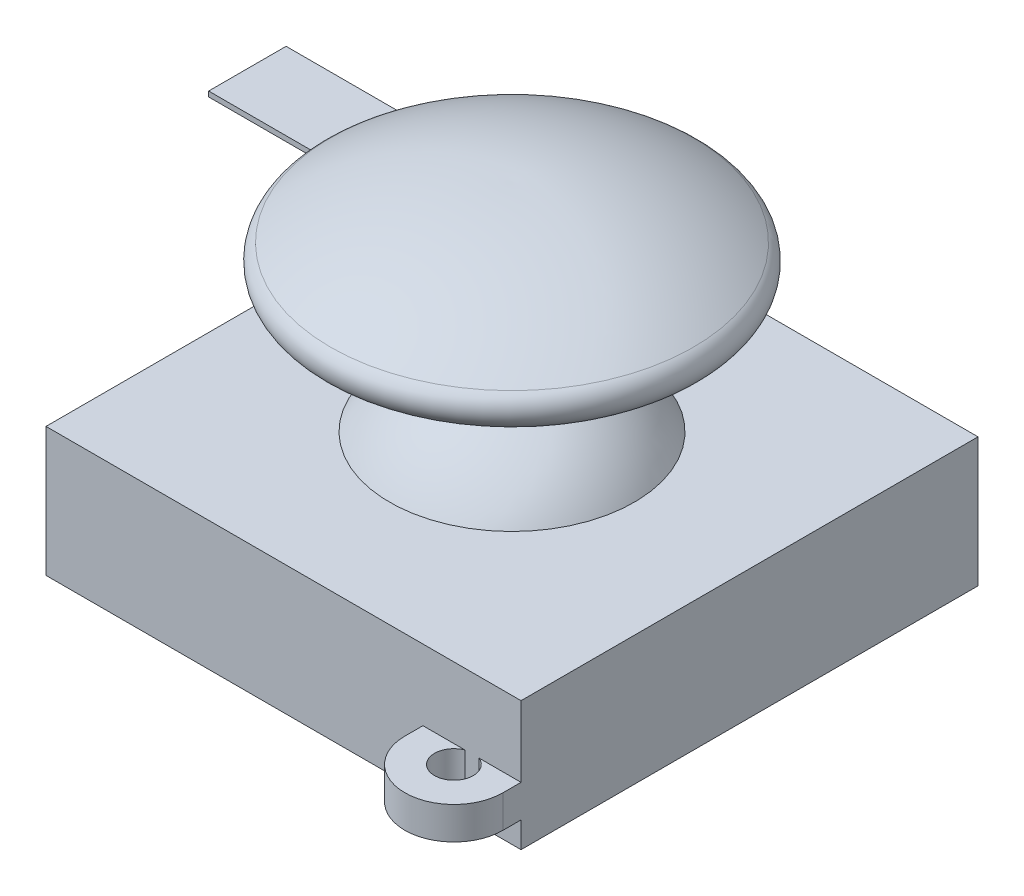
from build123d import *

# Parameters (mm, degrees)
SKETCH_1_W      = 18.4
SKETCH_1_H      = 17.7
EXTRUDE_1_DEPTH = 5
SKETCH_2_R      = 0.9
EXTRUDE_2_DEPTH = 1.26
EXTRUDE_3_DEPTH = 0.2


with BuildPart() as part:
    # 草图1 → 凸台-拉伸1 (new body)
    with BuildSketch(Plane(origin=(0, 0, 0), x_dir=(1, 0, 0), z_dir=(0, 1, 0))):
        Rectangle(SKETCH_1_W, SKETCH_1_H)
    extrude(amount=EXTRUDE_1_DEPTH)

    # 草图2 → 凸台-拉伸2 (add)
    # profile 1 of 2: a face of its own
    with BuildSketch(Plane(origin=(0, 1, 0), x_dir=(-1, 0, 0), z_dir=(0, -1, 0))):
        with BuildLine():
            Line((9.2, 8.85), (10.9, 8.85))
            ThreePointArc((10.9, 8.85), (12.8, 6.95), (10.9, 5.05))
            Line((10.9, 5.05), (9.2, 5.05))
            Line((9.2, 5.05), (9.2, 8.85))
        make_face()
        with Locations(Location((10.9, 6.95, 0), (0, 0, 90))):
            Circle(SKETCH_2_R, mode=Mode.SUBTRACT)
    # profile 2 of 2: a face of its own
    with BuildSketch(Plane(origin=(0, 1, 0), x_dir=(-1, 0, 0), z_dir=(0, -1, 0))):
        with BuildLine():
            Line((-9.2, -8.85), (-9.2, -9.55))
            ThreePointArc((-9.2, -9.55), (-7.3, -11.45), (-5.4, -9.55))
            Line((-5.4, -9.55), (-5.4, -8.85))
            Line((-5.4, -8.85), (-7.03074176, -8.85))
            ThreePointArc((-7.03074176, -8.85), (-7.3, -10.3), (-7.56925824, -8.85))
            Line((-7.56925824, -8.85), (-9.2, -8.85))
        make_face()
    extrude(amount=-EXTRUDE_2_DEPTH)

    # 草图3 → 旋转1 (revolve)
    with BuildSketch(Plane(origin=(0, 0, 0), x_dir=(0, 0, -1), z_dir=(1, 0, 0)), mode=Mode.PRIVATE) as revolve_1_sk:
        with BuildLine():
            Line((4.74, 5), (0, 5))
            Line((0, 5), (0, 7.605496402))
            Line((0, 7.605496402), (0, 13.4))
            ThreePointArc((0, 13.4), (3.673821956, 12.919048489), (7.026845746, 11.34249732))
            ThreePointArc((7.026845746, 11.34249732), (7.317837388, 10.519244236), (6.615835109, 10))
            Line((6.615835109, 10), (1.85, 10))
            Line((1.85, 10), (1.85, 7.291939811))
            ThreePointArc((1.85, 7.291939811), (3.488591696, 6.390077539), (4.74, 5))
        make_face()
    revolve(revolve_1_sk.sketch.rotate(Axis((0, 13.4, 0), (0, -1, 0)), 180), axis=Axis((0, 13.4, 0), (0, -1, 0)))

    # 草图4 → 凸台-拉伸3 (add)
    with BuildSketch(Plane(origin=(0, 0.2, 0), x_dir=(-1, 0, 0), z_dir=(0, -1, 0))):
        with BuildLine():
            Line((9.2, 8.85), (9.2, 9.207493888))
            ThreePointArc((9.2, 9.207493888), (9.476053649, 9.873946351), (10.142506112, 10.15))
            Line((10.142506112, 10.15), (21.9, 10.15))
            Line((21.9, 10.15), (21.9, 13.15))
            Line((21.9, 13.15), (10.05, 13.15))
            ThreePointArc((10.05, 13.15), (7.327638892, 12.022361108), (6.2, 9.3))
            Line((6.2, 9.3), (6.2, 8.85))
            Line((6.2, 8.85), (9.2, 8.85))
        make_face()
    extrude(amount=-EXTRUDE_3_DEPTH)


solid = part.part
